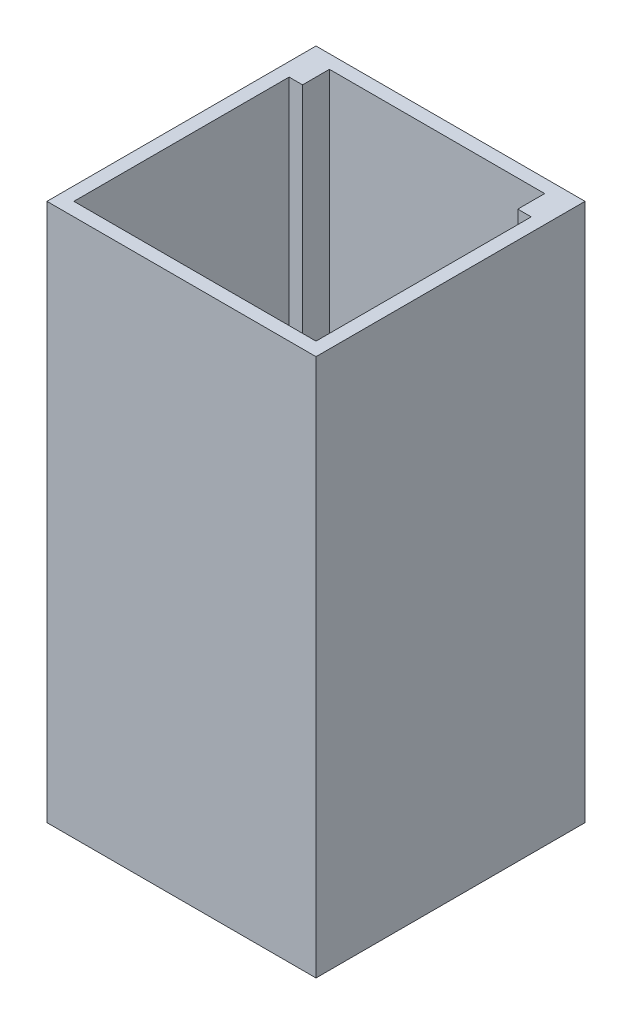
from build123d import *

# Parameters (mm, degrees)
SKETCH1_W           = 100
SKETCH1_H           = 100
BOSS_EXTRUDE1_DEPTH = 100
SHELL1_T            = -5
BOSS_EXTRUDE2_REACH = 214.132
SKETCH2_W           = 5
SKETCH2_H           = 10


with BuildPart() as part:
    # Sketch1 → Boss-Extrude1 (new, symmetric)
    with BuildSketch(Plane(origin=(0, 0, 0), x_dir=(-1, 0, 0), z_dir=(0, 1, 0))):
        Rectangle(SKETCH1_W, SKETCH1_H)
    extrude(amount=BOSS_EXTRUDE1_DEPTH, both=True)

    # Shell1
    shell1_openings = [part.faces().sort_by_distance(p)[0] for p in [
        (0, 100, 0),
    ]]
    offset(amount=SHELL1_T, openings=shell1_openings, kind=Kind.INTERSECTION)

    # Sketch2 → Boss-Extrude2 (add, up to next)
    with BuildSketch(Plane(origin=(0, 100, 0), x_dir=(-1, 0, 0), z_dir=(0, 1, 0)), mode=Mode.PRIVATE) as boss_extrude2_sk1:
        with Locations((-42.5, -40)):
            Rectangle(SKETCH2_W, SKETCH2_H)
    boss_extrude2_tool1 = extrude(boss_extrude2_sk1.sketch, amount=-BOSS_EXTRUDE2_REACH, mode=Mode.PRIVATE) - part.part
    # Sketch2 → Boss-Extrude2 (add, up to next)
    with BuildSketch(Plane(origin=(0, 100, 0), x_dir=(-1, 0, 0), z_dir=(0, 1, 0)), mode=Mode.PRIVATE) as boss_extrude2_sk2:
        with Locations((42.5, -40)):
            Rectangle(SKETCH2_W, SKETCH2_H)
    boss_extrude2_tool2 = extrude(boss_extrude2_sk2.sketch, amount=-BOSS_EXTRUDE2_REACH, mode=Mode.PRIVATE) - part.part
    add(boss_extrude2_tool1.solids().sort_by_distance((42.5, 100, -40))[0])
    add(boss_extrude2_tool2.solids().sort_by_distance((-42.5, 100, -40))[0])


solid = part.part
